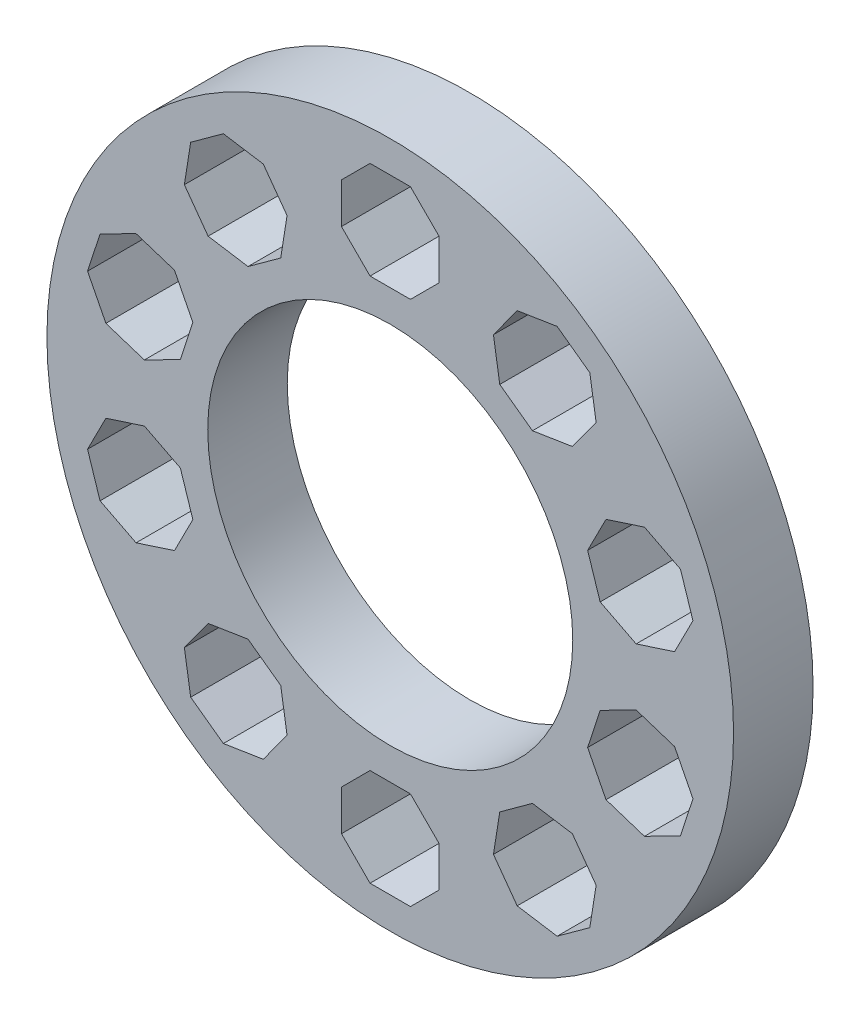
from build123d import *

# Parameters (mm, degrees)
CROQUIS1_R              = 19
CROQUIS1_R_2            = 10.1
SALIENTE_EXTRUIR1_DEPTH = 4.4
CORTAR_EXTRUIR1_DEPTH   = 4.4
MATRIZC1_COUNT          = 10


with BuildPart() as part:
    # Croquis1 → Saliente-Extruir1 (new body)
    with BuildSketch(Plane(origin=(0, 0, 0), x_dir=(0, 1, 0), z_dir=(0, 0, 1))):
        with Locations(Location((0, 0, 0), (0, 0, 270))):
            Circle(CROQUIS1_R)
        with Locations(Location((0, 0, 0), (0, 0, 270))):
            Circle(CROQUIS1_R_2, mode=Mode.SUBTRACT)
    extrude(amount=SALIENTE_EXTRUIR1_DEPTH)

    # Croquis2 → Cortar-Extruir1 (cut)
    with BuildSketch(Plane.XY.offset(4.4)):
        Polygon((2.7, 13.431623382), (2.7, 15.668376618), (1.118376618, 17.25), (-1.118376618, 17.25), (-2.7, 15.668376618), (-2.7, 13.431623382), (-1.118376618, 11.85), (1.118376618, 11.85), align=None)
    cortar_extruir1 = extrude(amount=-CORTAR_EXTRUIR1_DEPTH, mode=Mode.SUBTRACT)

    # MatrizC1: Cortar-Extruir1 ×10 about axis
    matrizc1_axis = Axis((0, 0, 0), (0, 0, 1))
    for i in range(1, MATRIZC1_COUNT):
        add(cortar_extruir1.rotate(matrizc1_axis, i * 360 / MATRIZC1_COUNT), mode=Mode.SUBTRACT)


solid = part.part
